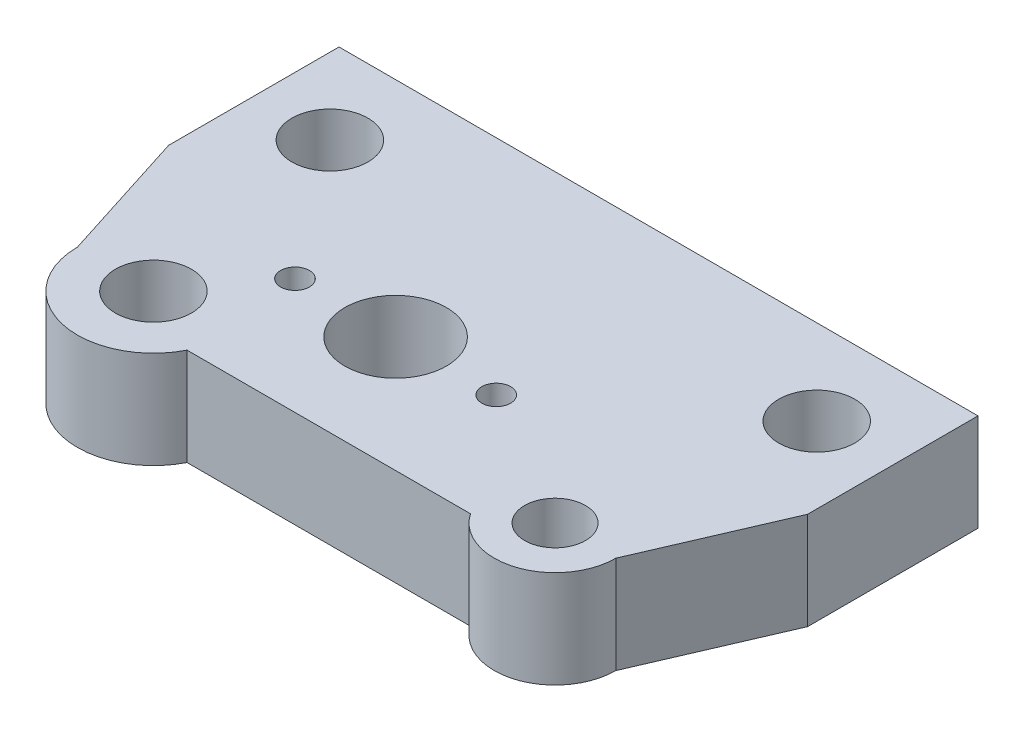
from build123d import *

# Parameters (mm, degrees)
SKETCH1_R           = 3.96875
SKETCH1_R_2         = 3.175
SKETCH1_R_3         = 5.3
SKETCH1_R_4         = 1.5
BOSS_EXTRUDE1_DEPTH = 10.16


with BuildPart() as part:
    # Sketch1 → Boss-Extrude1 (new body)
    with BuildSketch(Plane(origin=(0, 0, 0), x_dir=(1, 0, 0), z_dir=(0, 1, 0))):
        with BuildLine():
            Line((54.2925, 31.75), (-12.3825, 31.75))
            Line((-12.3825, 31.75), (-12.3825, 13.97))
            Line((-12.3825, 13.97), (-7.9375, 0))
            ThreePointArc((-7.9375, 0), (-1.838169821, -7.721725064), (7.086131612, -3.576401128))
            Line((7.086131612, -3.576401128), (36.662919386, -3.576401128))
            ThreePointArc((36.662919386, -3.576401128), (43.781301432, -6.068008813), (48.26, 0))
            Line((48.26, 0), (54.2925, 13.97))
            Line((54.2925, 13.97), (54.2925, 31.75))
        make_face()
        with Locations(Location((0, 0, 0), (0, 0, 270))):
            Circle(SKETCH1_R, mode=Mode.SUBTRACT)
        with Locations(Location((41.91, 0, 0), (0, 0, 270))):
            Circle(SKETCH1_R_2, mode=Mode.SUBTRACT)
        with Locations(Location((46.355, 22.86, 0), (0, 0, 270))):
            Circle(SKETCH1_R, mode=Mode.SUBTRACT)
        with Locations(Location((-4.445, 22.86, 0), (0, 0, 270))):
            Circle(SKETCH1_R, mode=Mode.SUBTRACT)
        with Locations(Location((16.764, 8.509, 0), (0, 0, 270))):
            Circle(SKETCH1_R_3, mode=Mode.SUBTRACT)
        with Locations(Location((6.264, 8.509, 0), (0, 0, 270))):
            Circle(SKETCH1_R_4, mode=Mode.SUBTRACT)
        with Locations(Location((27.264, 8.509, 0), (0, 0, 270))):
            Circle(SKETCH1_R_4, mode=Mode.SUBTRACT)
    extrude(amount=-BOSS_EXTRUDE1_DEPTH)


solid = part.part
